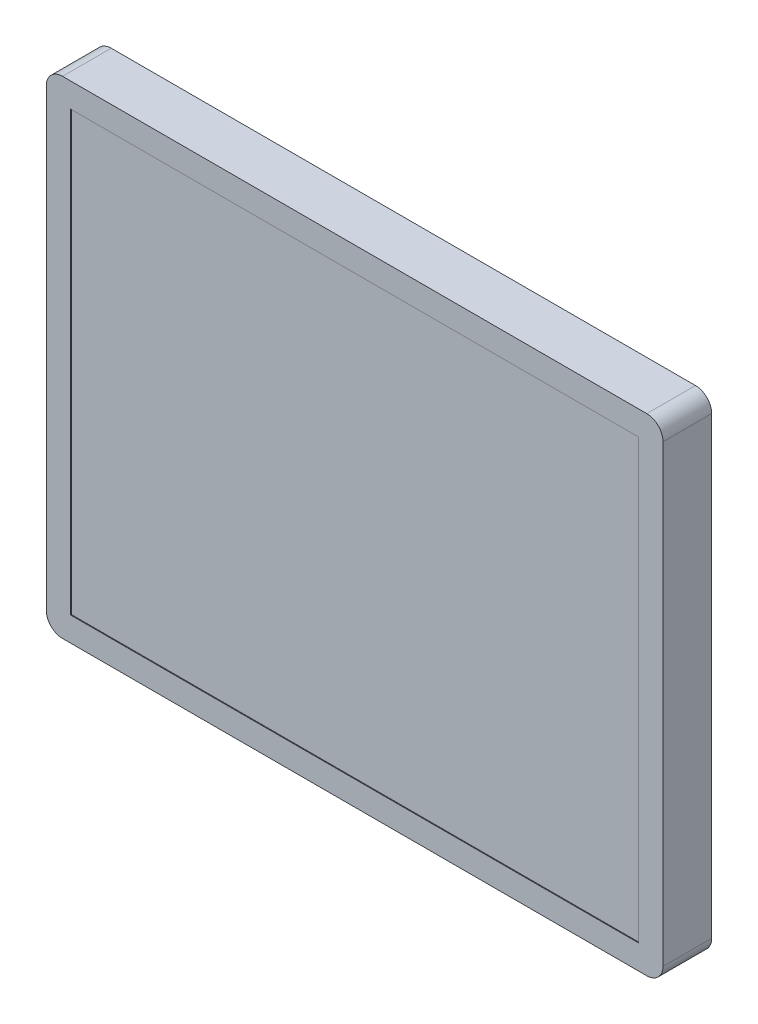
from build123d import *

# Parameters (mm, degrees)
SKETCH_1_W          = 380
SKETCH_1_H          = 300
EXTRUDE_1_DEPTH     = 30
SKETCH_2_W          = 350
SKETCH_2_H          = 270
CUT_EXTRUDE_1_DEPTH = 0.5
FILLET_1_R          = 10


with BuildPart() as part:
    # 草图1 → 凸台-拉伸1 (new body)
    with BuildSketch(Plane.XY):
        with Locations((190, 150)):
            Rectangle(SKETCH_1_W, SKETCH_1_H)
    extrude(amount=EXTRUDE_1_DEPTH)

    # 草图2 → 切除-拉伸1 (cut)
    with BuildSketch(Plane.XY.offset(30)):
        with Locations((190, 150)):
            Rectangle(SKETCH_2_W, SKETCH_2_H)
    extrude(amount=-CUT_EXTRUDE_1_DEPTH, mode=Mode.SUBTRACT)

    # 圆角1
    fillet_1_edges = [part.edges().sort_by_distance(p)[0] for p in [
        (0, 300, 15),
        (380, 300, 15),
        (380, 0, 15),
        (0, 0, 15),
    ]]
    fillet(fillet_1_edges, radius=FILLET_1_R)


solid = part.part
